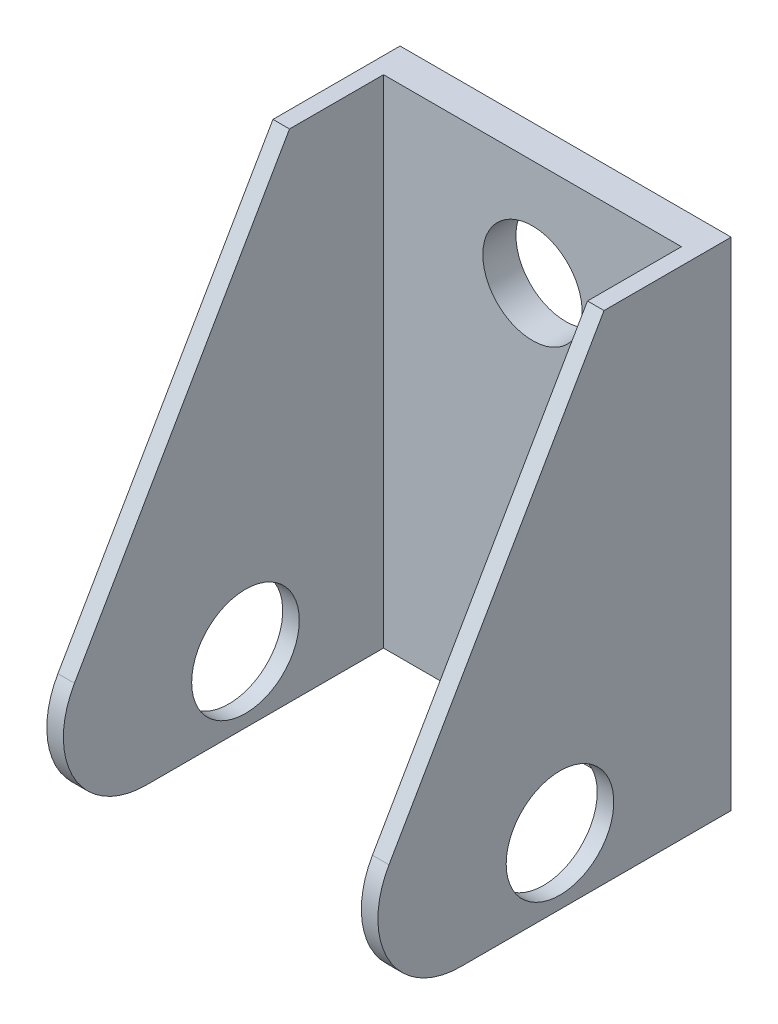
from build123d import *

# Parameters (mm, degrees)
SKETCH1_W           = 20
SKETCH1_H           = 30
BOSS_EXTRUDE1_DEPTH = 2
BOSS_EXTRUDE2_DEPTH = 1
LPATTERN1_COUNT     = 2
LPATTERN1_PITCH     = 19
FILLET1_R           = 5
FILLET2_R           = 5
SKETCH3_R           = 3.25
CUT_EXTRUDE1_DEPTH  = 33.869206831
SKETCH4_R           = 3
CUT_EXTRUDE2_DEPTH  = 28.935367507


with BuildPart() as part:
    # Sketch1 → Boss-Extrude1 (new body)
    with BuildSketch(Plane.XY):
        Rectangle(SKETCH1_W, SKETCH1_H)
    extrude(amount=BOSS_EXTRUDE1_DEPTH)

    # Sketch2 → Boss-Extrude2 (add)
    with BuildSketch(Plane(origin=(10, 0, 0), x_dir=(0, 0, -1), z_dir=(1, 0, 0))):
        Polygon((-2, 15), (-7.679491924, 15), (-25, -15), (-2, -15), align=None)
    boss_extrude2 = extrude(amount=-BOSS_EXTRUDE2_DEPTH)

    # LPattern1: Boss-Extrude2 ×2
    with Locations(*[(-i * LPATTERN1_PITCH, 0, 0) for i in range(1, LPATTERN1_COUNT)]):
        add(boss_extrude2)

    # Fillet1
    fillet1_edges = [part.edges().sort_by_distance(p)[0] for p in [
        (-9.5, -15, 25),
    ]]
    fillet(fillet1_edges, radius=FILLET1_R)

    # Fillet2
    fillet2_edges = [part.edges().sort_by_distance(p)[0] for p in [
        (9.5, -15, 25),
    ]]
    fillet(fillet2_edges, radius=FILLET2_R)

    # Sketch3 → Cut-Extrude1 (cut, through all)
    with BuildSketch(Plane.ZY.offset(10)):
        with Locations((10.339745962, -11)):
            Circle(SKETCH3_R)
    extrude(amount=-CUT_EXTRUDE1_DEPTH, mode=Mode.SUBTRACT)

    # Sketch4 → Cut-Extrude2 (cut, through all)
    with BuildSketch(Plane(origin=(0, 0, 0), x_dir=(-1, 0, 0), z_dir=(0, 0, -1))):
        with Locations((0, 8.588876522)):
            Circle(SKETCH4_R)
    extrude(amount=-CUT_EXTRUDE2_DEPTH, mode=Mode.SUBTRACT)


solid = part.part
